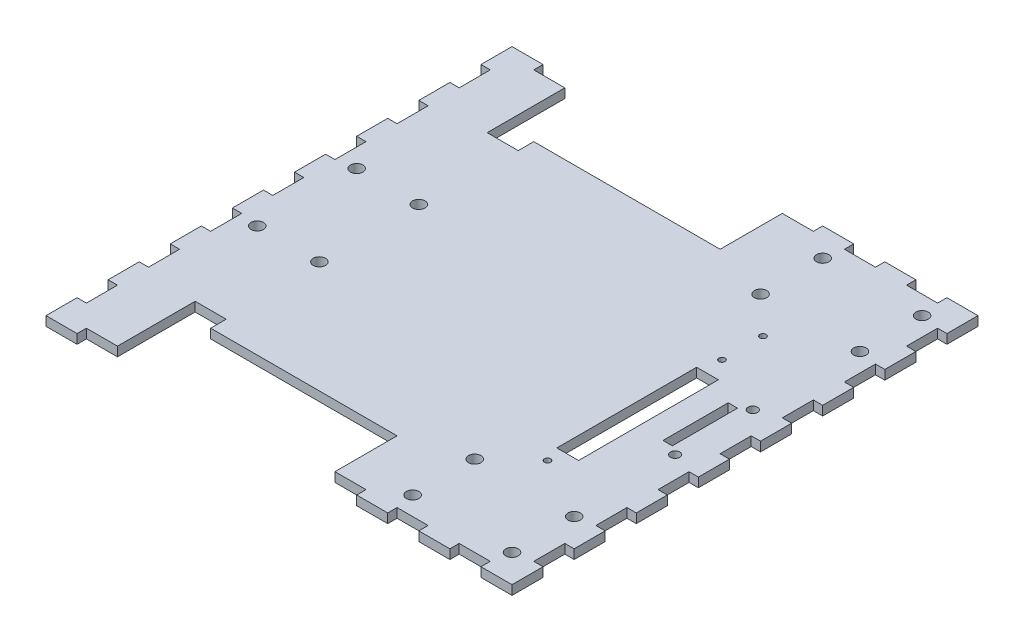
from build123d import *

# Parameters (mm, degrees)
CROQUIS1_R              = 1.5
CROQUIS1_R_2            = 2
CROQUIS1_R_3            = 1
CROQUIS1_W              = 7
CROQUIS1_H              = 45
SALIENTE_EXTRUIR2_DEPTH = 3


with BuildPart() as part:
    # Croquis1 → Saliente-Extruir2 (new body)
    with BuildSketch(Plane(origin=(0, 0, 0), x_dir=(1, 0, 0), z_dir=(0, 1, 0))):
        Polygon((-75, -75), (-75, -65), (-72, -65), (-72, -55), (-75, -55), (-75, -45), (-72, -45), (-72, -35), (-75, -35), (-75, -25), (-72, -25), (-72, -15), (-75, -15), (-75, -5), (-72, -5), (-72, 5), (-75, 5), (-75, 15), (-72, 15), (-72, 25), (-75, 25), (-75, 35), (-72, 35), (-72, 45), (-75, 45), (-75, 55), (-72, 55), (-72, 65), (-75, 65), (-75, 75), (-65, 75), (-65, 72), (-55, 72), (-55, 47), (-45, 47), (-45, 52), (15, 52), (15, 72), (25, 72), (25, 75), (35, 75), (35, 72), (45, 72), (45, 75), (55, 75), (55, 72), (65, 72), (65, 75), (75, 75), (75, 65), (72, 65), (72, 55), (75, 55), (75, 45), (72, 45), (72, 35), (75, 35), (75, 25), (72, 25), (72, 15), (75, 15), (75, 5), (72, 5), (72, -5), (75, -5), (75, -15), (72, -15), (72, -25), (75, -25), (75, -35), (72, -35), (72, -45), (75, -45), (75, -55), (72, -55), (72, -65), (75, -65), (75, -75), (65, -75), (65, -72), (55, -72), (55, -75), (45, -75), (45, -72), (35, -72), (35, -75), (25, -75), (25, -72), (15, -72), (15, -52), (-45, -52), (-45, -47), (-55, -47), (-55, -72), (-65, -72), (-65, -75), align=None)
        with Locations(Location((65, 12.5, 0), (0, 0, 270))):
            Circle(CROQUIS1_R, mode=Mode.SUBTRACT)
        with Locations(Location((65, -12.5, 0), (0, 0, 90))):
            Circle(CROQUIS1_R, mode=Mode.SUBTRACT)
        with Locations(Location((66, 66, 0), (0, 0, 270))):
            Circle(CROQUIS1_R_2, mode=Mode.SUBTRACT)
        with Locations(Location((34, 66, 0), (0, 0, 270))):
            Circle(CROQUIS1_R_2, mode=Mode.SUBTRACT)
        with Locations(Location((66, 46, 0), (0, 0, 270))):
            Circle(CROQUIS1_R_2, mode=Mode.SUBTRACT)
        with Locations(Location((34, 46, 0), (0, 0, 270))):
            Circle(CROQUIS1_R_2, mode=Mode.SUBTRACT)
        with Locations(Location((66, -46, 0), (0, 0, 90))):
            Circle(CROQUIS1_R_2, mode=Mode.SUBTRACT)
        with Locations(Location((34, -46, 0), (0, 0, 90))):
            Circle(CROQUIS1_R_2, mode=Mode.SUBTRACT)
        with Locations(Location((66, -66, 0), (0, 0, 90))):
            Circle(CROQUIS1_R_2, mode=Mode.SUBTRACT)
        with Locations(Location((34, -66, 0), (0, 0, 90))):
            Circle(CROQUIS1_R_2, mode=Mode.SUBTRACT)
        with Locations(Location((-66, 16, 0), (0, 0, 270))):
            Circle(CROQUIS1_R_2, mode=Mode.SUBTRACT)
        with Locations(Location((-66, -16, 0), (0, 0, 270))):
            Circle(CROQUIS1_R_2, mode=Mode.SUBTRACT)
        with Locations(Location((-46, 16, 0), (0, 0, 270))):
            Circle(CROQUIS1_R_2, mode=Mode.SUBTRACT)
        with Locations(Location((-46, -16, 0), (0, 0, 270))):
            Circle(CROQUIS1_R_2, mode=Mode.SUBTRACT)
        with Locations(Location((46.1, 34.675, 0), (0, 0, 270))):
            Circle(CROQUIS1_R_3, mode=Mode.SUBTRACT)
        with Locations(Location((46.1, -34.675, 0), (0, 0, 90))):
            Circle(CROQUIS1_R_3, mode=Mode.SUBTRACT)
        with Locations(Location((46.1, 21.475, 0), (0, 0, 270))):
            Circle(CROQUIS1_R_3, mode=Mode.SUBTRACT)
        Polygon((59.1, -10.5), (59.1, -7.5), (59.1, 7.5), (59.1, 10.5), (62.1, 10.5), (62.1, -10.5), align=None, mode=Mode.SUBTRACT)
        with Locations((47.6, -7.175)):
            Rectangle(CROQUIS1_W, CROQUIS1_H, mode=Mode.SUBTRACT)
    extrude(amount=SALIENTE_EXTRUIR2_DEPTH)


solid = part.part
